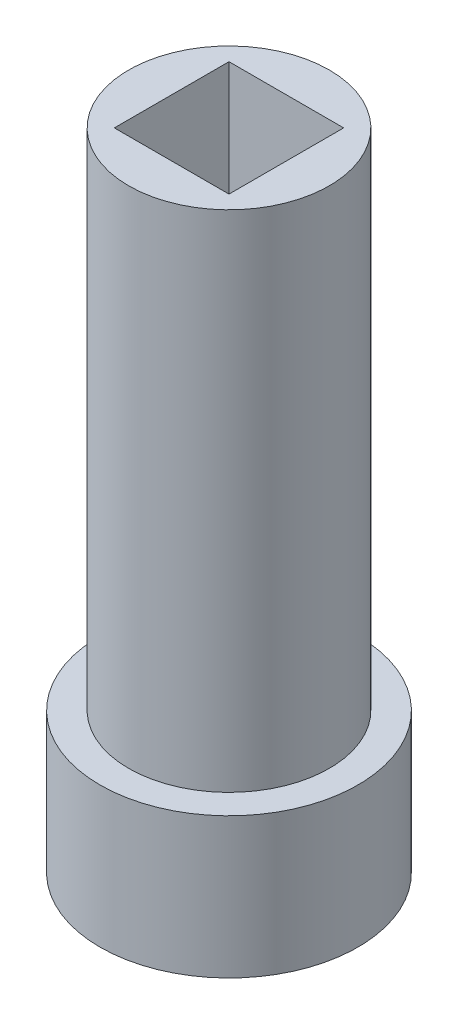
from build123d import *

# Parameters (mm, degrees)
SKETCH1_R           = 7
BOSS_EXTRUDE1_DEPTH = 45
SKETCH2_W           = 8
SKETCH2_H           = 8
CUT_EXTRUDE1_DEPTH  = 22
SKETCH3_R           = 9
BOSS_EXTRUDE2_DEPTH = 9.8


with BuildPart() as part:
    # Sketch1 → Boss-Extrude1 (new body)
    with BuildSketch(Plane(origin=(0, 0, 0), x_dir=(1, 0, 0), z_dir=(0, 1, 0))):
        with Locations(Location((0, 0, 0), (0, 0, 90))):
            Circle(SKETCH1_R)
    extrude(amount=BOSS_EXTRUDE1_DEPTH)

    # Sketch2 → Cut-Extrude1 (cut)
    with BuildSketch(Plane(origin=(0, 45, 0), x_dir=(1, 0, 0), z_dir=(0, 1, 0))):
        Rectangle(SKETCH2_W, SKETCH2_H)
    extrude(amount=-CUT_EXTRUDE1_DEPTH, mode=Mode.SUBTRACT)

    # Sketch3 → Boss-Extrude2 (add)
    with BuildSketch(Plane.XZ):
        with Locations(Location((0, 0, 0), (0, 0, 270))):
            Circle(SKETCH3_R)
    extrude(amount=-BOSS_EXTRUDE2_DEPTH)


solid = part.part
